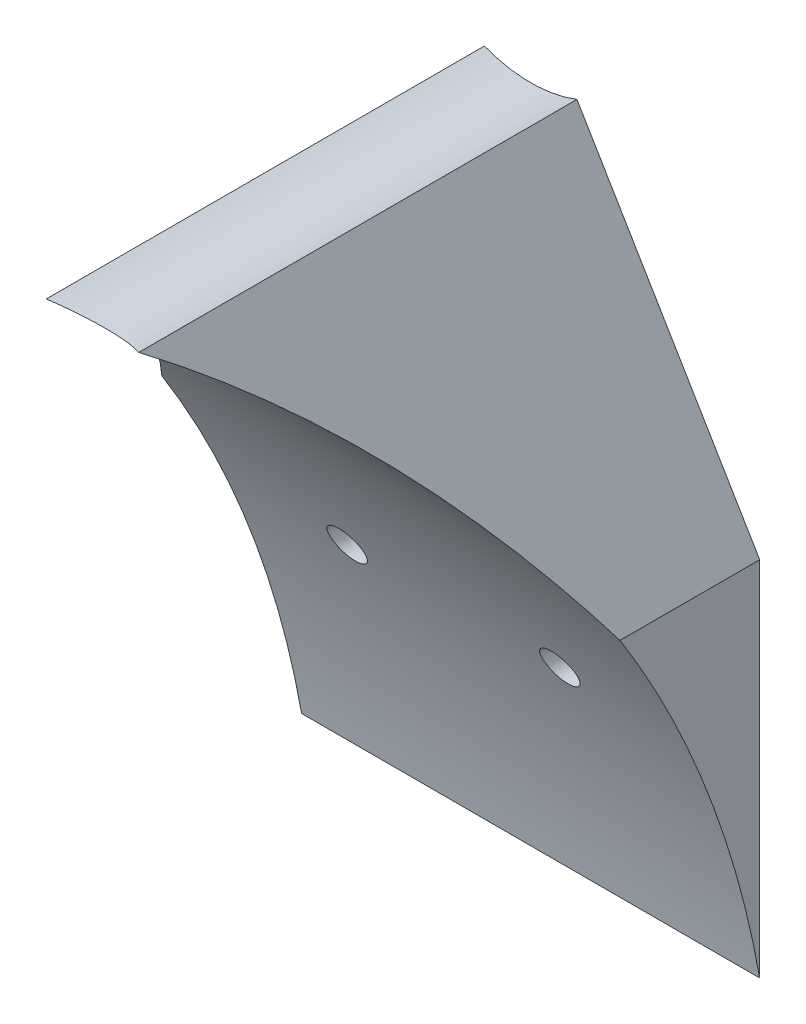
from build123d import *

# Parameters (mm, degrees)
BOSS_EXTRUDE1_DEPTH  = 76.2
CUT_EXTRUDE1_START   = -34.198033
CUT_EXTRUDE1_DEPTH   = 68.396066318
M5_CLEARANCE_HOLE1_D = 5.5
CUT_EXTRUDE2_REACH   = 144.97
SKETCH10_R           = 19.05


with BuildPart() as part:
    # Sketch1 → Boss-Extrude1 (new body)
    with BuildSketch(Plane.XY):
        Polygon((34.198033159, -120.876287401), (34.198033159, -66.796344186), (0, -9.314618425), (-34.198033159, -66.796344186), (-34.198033159, -120.876287401), align=None)
    extrude(amount=BOSS_EXTRUDE1_DEPTH)

    # Sketch2 → Cut-Extrude1 (cut)
    with BuildSketch(Plane(origin=(0, 0, 0), x_dir=(0, 0, -1), z_dir=(1, 0, 0)).offset(CUT_EXTRUDE1_START)):
        with BuildLine():
            Line((-76.2, -120.876287401), (0, -120.876287401))
            ThreePointArc((0, -120.876287401), (-23.444492551, -62.806448146), (-68.2625, -19.067487592))
            Line((-68.2625, -19.067487592), (-68.2625, -9.314618425))
            Line((-68.2625, -9.314618425), (-76.2, -9.314618425))
            Line((-76.2, -9.314618425), (-76.2, -22.225))
            Line((-76.2, -22.225), (-76.2, -66.796344186))
            Line((-76.2, -66.796344186), (-76.2, -120.876287401))
        make_face()
    extrude(amount=CUT_EXTRUDE1_DEPTH, mode=Mode.SUBTRACT)

    # M5 Clearance Hole1 (through all)
    with Locations(Plane(origin=(0, 0, 0), x_dir=(-1, 0, 0), z_dir=(0, 0, -1))):
        with Locations((-15.875, -84.114050529), (15.875, -84.114050529), (0, -41.712872808)):
            Hole(M5_CLEARANCE_HOLE1_D / 2)

    # Sketch10 → Cut-Extrude2 (cut, up to next)
    with BuildSketch(Plane(origin=(0, 0, 0), x_dir=(-1, 0, 0), z_dir=(0, 0, -1)), mode=Mode.PRIVATE) as cut_extrude2_sk1:
        with Locations((0, -3.175)):
            Circle(SKETCH10_R)
    cut_extrude2_tool1 = extrude(cut_extrude2_sk1.sketch, amount=-CUT_EXTRUDE2_REACH, mode=Mode.PRIVATE) & part.part
    add(cut_extrude2_tool1.solids().sort_by_distance((0, -3.175, 0))[0], mode=Mode.SUBTRACT)


solid = part.part
